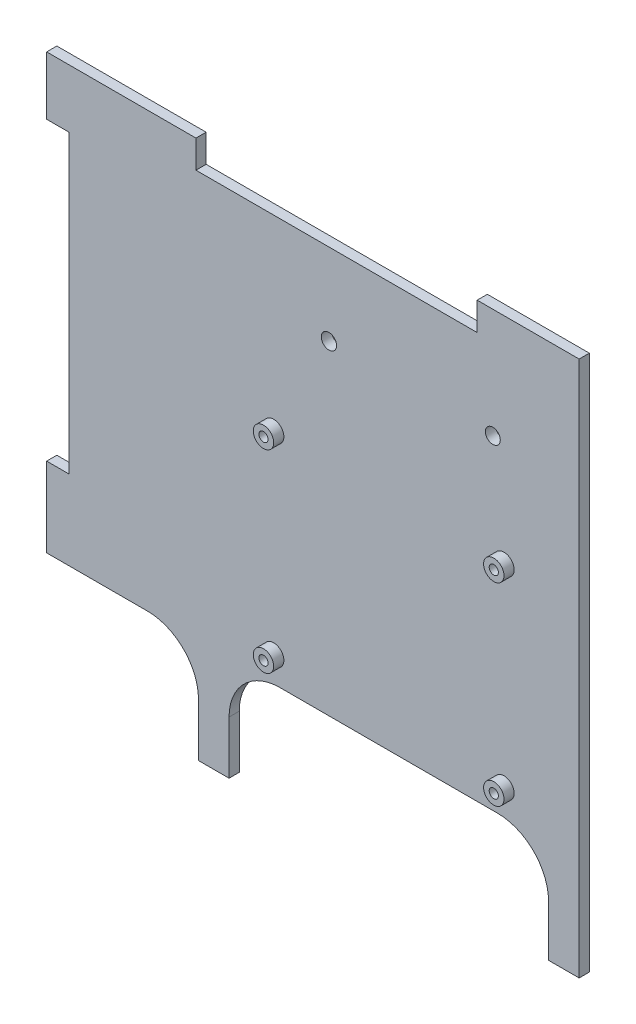
from build123d import *

# Parameters (mm, degrees)
BOSS_EXTRUDE1_DEPTH = 2.54
SKETCH3_R           = 2.54
BOSS_EXTRUDE2_DEPTH = 2.54
SKETCH4_R           = 1.143
CUT_EXTRUDE1_DEPTH  = 152.042782279
SKETCH5_R           = 1.858808724
SKETCH5_R_2         = 1.906231368
CUT_EXTRUDE2_DEPTH  = 151.978698095


with BuildPart() as part:
    # Sketch2 → Boss-Extrude1 (new body)
    with BuildSketch(Plane.XY):
        with BuildLine():
            Line((-114.427, 27.932368959), (-120.015, 27.932368959))
            Line((-120.015, 27.932368959), (-120.015, 42.483412464))
            Line((-120.015, 42.483412464), (-82.806810404, 42.483412464))
            Line((-82.806810404, 42.483412464), (-82.801193697, 35.552368959))
            Line((-82.801193697, 35.552368959), (-12.708278928, 35.552368959))
            Line((-12.708278928, 35.552368959), (-12.713937882, 42.544153403))
            Line((-12.713937882, 42.544153403), (12.708274756, 42.545846409))
            Line((12.708274756, 42.545846409), (12.708274756, -33.146999807))
            Line((12.708274756, -33.146999807), (12.708274756, -91.058999807))
            Line((12.708274756, -91.058999807), (5.088274756, -91.058999807))
            Line((5.088274756, -91.058999807), (5.088274756, -78.358999807))
            ThreePointArc((5.088274756, -78.358999807), (1.368530877, -69.378743686), (-7.611725244, -65.658999807))
            Line((-7.611725244, -65.658999807), (-61.849, -65.658999807))
            ThreePointArc((-61.849, -65.658999807), (-70.829256121, -69.378743686), (-74.549, -78.358999807))
            Line((-74.549, -78.358999807), (-74.549, -85.724999807))
            Line((-74.549, -85.724999807), (-74.549, -91.566999807))
            Line((-74.549, -91.566999807), (-82.169, -91.566999807))
            Line((-82.169, -91.566999807), (-82.169, -85.724999807))
            Line((-82.169, -85.724999807), (-82.169, -78.358999807))
            ThreePointArc((-82.169, -78.358999807), (-85.888743879, -69.378743686), (-94.869, -65.658999807))
            Line((-94.869, -65.658999807), (-120.015, -65.658999807))
            Line((-120.015, -65.658999807), (-120.015, -45.846999807))
            Line((-120.015, -45.846999807), (-114.427, -45.846999807))
            Line((-114.427, -45.846999807), (-114.427, 27.932368959))
        make_face()
    extrude(amount=BOSS_EXTRUDE1_DEPTH)

    # Sketch3 → Boss-Extrude2 (add)
    with BuildSketch(Plane.XY.offset(2.54)):
        with Locations((-63.432362622, -59.308999807)):
            Circle(SKETCH3_R)
        with Locations((-6.028362622, -59.308999807)):
            Circle(SKETCH3_R)
        with Locations((-6.028362622, -11.048999807)):
            Circle(SKETCH3_R)
        with Locations((-63.432362622, -11.048999807)):
            Circle(SKETCH3_R)
    extrude(amount=BOSS_EXTRUDE2_DEPTH)

    # Sketch4 → Cut-Extrude1 (cut, through all)
    with BuildSketch(Plane.XY.offset(5.08)):
        with Locations((-6.028362622, -59.308999807)):
            Circle(SKETCH4_R)
        with Locations((-63.432362622, -59.308999807)):
            Circle(SKETCH4_R)
        with Locations((-63.432362622, -11.048999807)):
            Circle(SKETCH4_R)
        with Locations((-6.028362622, -11.048999807)):
            Circle(SKETCH4_R)
    extrude(amount=-CUT_EXTRUDE1_DEPTH, mode=Mode.SUBTRACT)

    # Sketch5 → Cut-Extrude2 (cut, through all)
    with BuildSketch(Plane.XY.offset(2.54)):
        with Locations((-8.811927589, 15.209269476)):
            Circle(SKETCH5_R)
        with Locations((-49.660967681, 15.209269476)):
            Circle(SKETCH5_R_2)
    extrude(amount=-CUT_EXTRUDE2_DEPTH, mode=Mode.SUBTRACT)


solid = part.part
